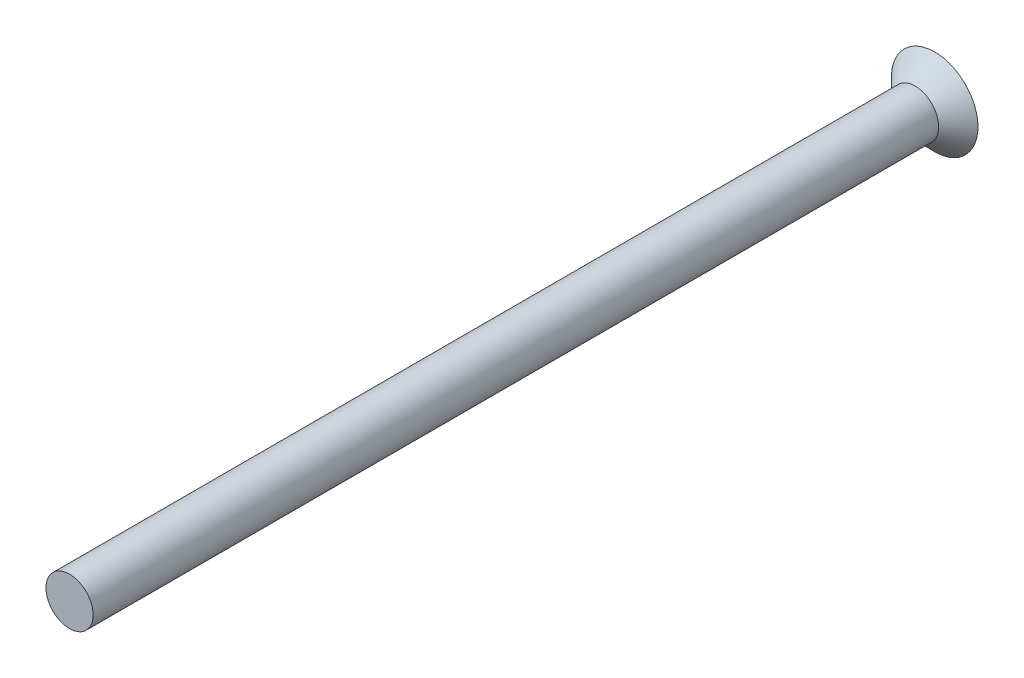
from build123d import *

# Parameters (mm, degrees)
M3_55MM_START    = 1.25
SKETCH_1_R       = 1.5
M3_55MM_DEPTH    = 53.75
SKETCH_2_R       = 2.75
M3_D5P5_90_DEPTH = 1.25
M3_D5P5_90_TAPER = 45


with BuildPart() as part:
    # 草图1 → M3简化螺杆_沉头总长55mm (new body)
    with BuildSketch(Plane.XY.offset(M3_55MM_START)):
        Circle(SKETCH_1_R)
    extrude(amount=M3_55MM_DEPTH)

    # 草图2 → M3沉头_D5p5_90度 (add)
    with BuildSketch(Plane.XY):
        Circle(SKETCH_2_R)
    extrude(amount=M3_D5P5_90_DEPTH, taper=M3_D5P5_90_TAPER)


solid = part.part
